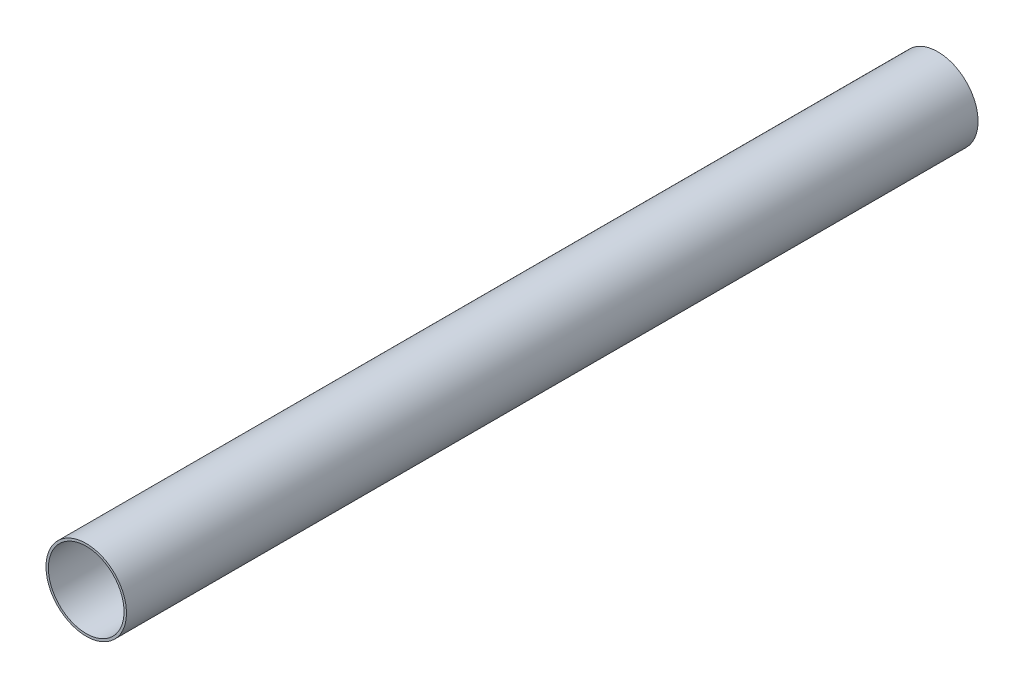
from build123d import *

# Parameters (mm, degrees)
SKETCH1_R           = 8.5
SKETCH1_R_2         = 8
BOSS_EXTRUDE1_DEPTH = 180


with BuildPart() as part:
    # Sketch1 → Boss-Extrude1 (new body)
    with BuildSketch(Plane.XY):
        with Locations(Location((0, 0, 0), (0, 0, 180))):
            Circle(SKETCH1_R)
        with Locations(Location((0, 0, 0), (0, 0, 180))):
            Circle(SKETCH1_R_2, mode=Mode.SUBTRACT)
    extrude(amount=BOSS_EXTRUDE1_DEPTH)


solid = part.part
